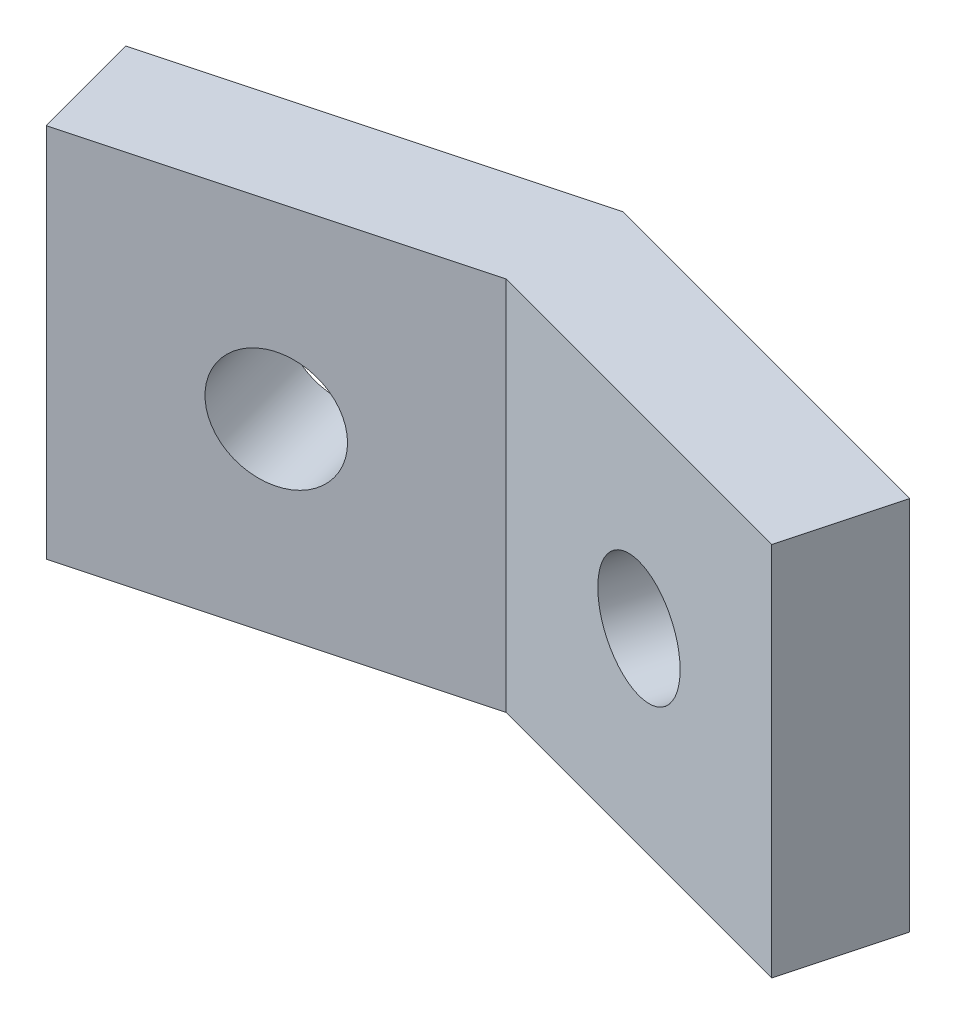
from build123d import *

# Parameters (mm, degrees)
BOSS_EXTRUDE1_DEPTH = 10
SKETCH5_R           = 1.55
CUT_EXTRUDE3_DEPTH  = 10
SKETCH6_R           = 1.55
CUT_EXTRUDE4_DEPTH  = 10


with BuildPart() as part:
    # Sketch1 → Boss-Extrude1 (new body)
    with BuildSketch(Plane(origin=(0, 0, 0), x_dir=(1, 0, 0), z_dir=(0, 1, 0))):
        Polygon((0, 1.552914271), (-10.435715398, -1.243327243), (-9.659258263, -4.141104722), (0, -1.552914271), (9.659258263, -4.141104722), (10.435715398, -1.243327243), align=None)
    extrude(amount=BOSS_EXTRUDE1_DEPTH)

    # Sketch5 → Cut-Extrude3 (cut)
    with BuildSketch(Plane(origin=(0.388228568, 0, 1.448888739), x_dir=(0.9659258262890673, 0, -0.2588190451025247), z_dir=(0.2588190451025247, 0, 0.9659258262890673))):
        with Locations((-5.401923789, 5)):
            Circle(SKETCH5_R)
    extrude(amount=-CUT_EXTRUDE3_DEPTH, mode=Mode.SUBTRACT)

    # Sketch6 → Cut-Extrude4 (cut)
    with BuildSketch(Plane(origin=(-0.388228568, 0, 1.448888739), x_dir=(0.9659258262890674, 0, 0.2588190451025243), z_dir=(-0.2588190451025243, 0, 0.9659258262890674))):
        with Locations((5.401923789, 5)):
            Circle(SKETCH6_R)
    extrude(amount=-CUT_EXTRUDE4_DEPTH, mode=Mode.SUBTRACT)


solid = part.part
